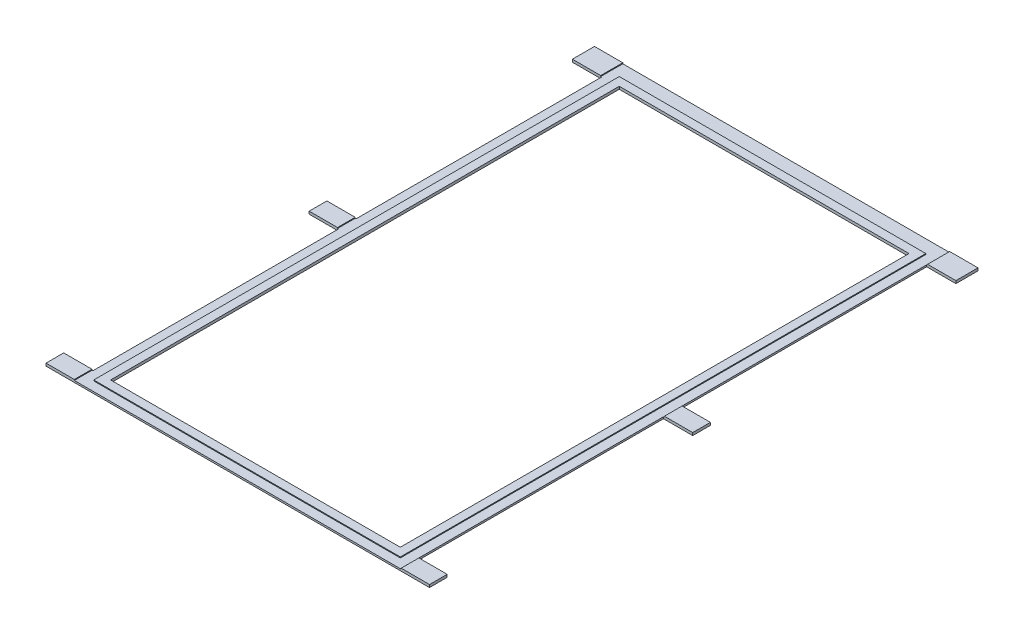
from build123d import *

# Parameters (mm, degrees)
SKETCH1_W           = 655
SKETCH1_H           = 1150
BOSS_EXTRUDE1_DEPTH = 6
SKETCH2_W           = 739
SKETCH2_H           = 1260
SKETCH2_W_2         = 693
SKETCH2_H_2         = 1188
CUT_EXTRUDE1_DEPTH  = 2


with BuildPart() as part:
    # Sketch1 → Boss-Extrude1 (new body)
    with BuildSketch(Plane(origin=(0, 0, 0), x_dir=(1, 0, 0), z_dir=(0, 1, 0))):
        Polygon((-433.5, 620), (433.5, 620), (433.5, 570), (367.5, 570), (367.5, 15), (433.5, 15), (433.5, -25), (367.5, -25), (367.5, -580), (433.5, -580), (433.5, -620), (-433.5, -620), (-433.5, -580), (-367.5, -580), (-367.5, -25), (-433.5, -25), (-433.5, 15), (-367.5, 15), (-367.5, 570), (-433.5, 570), align=None)
        with Locations((0, -5)):
            Rectangle(SKETCH1_W, SKETCH1_H, mode=Mode.SUBTRACT)
    extrude(amount=BOSS_EXTRUDE1_DEPTH)

    # Sketch2 → Cut-Extrude1 (cut)
    with BuildSketch(Plane(origin=(0, 6, 0), x_dir=(1, 0, 0), z_dir=(0, 1, 0))):
        Rectangle(SKETCH2_W, SKETCH2_H)
        with Locations((0, -5)):
            Rectangle(SKETCH2_W_2, SKETCH2_H_2, mode=Mode.SUBTRACT)
    extrude(amount=-CUT_EXTRUDE1_DEPTH, mode=Mode.SUBTRACT)


solid = part.part
